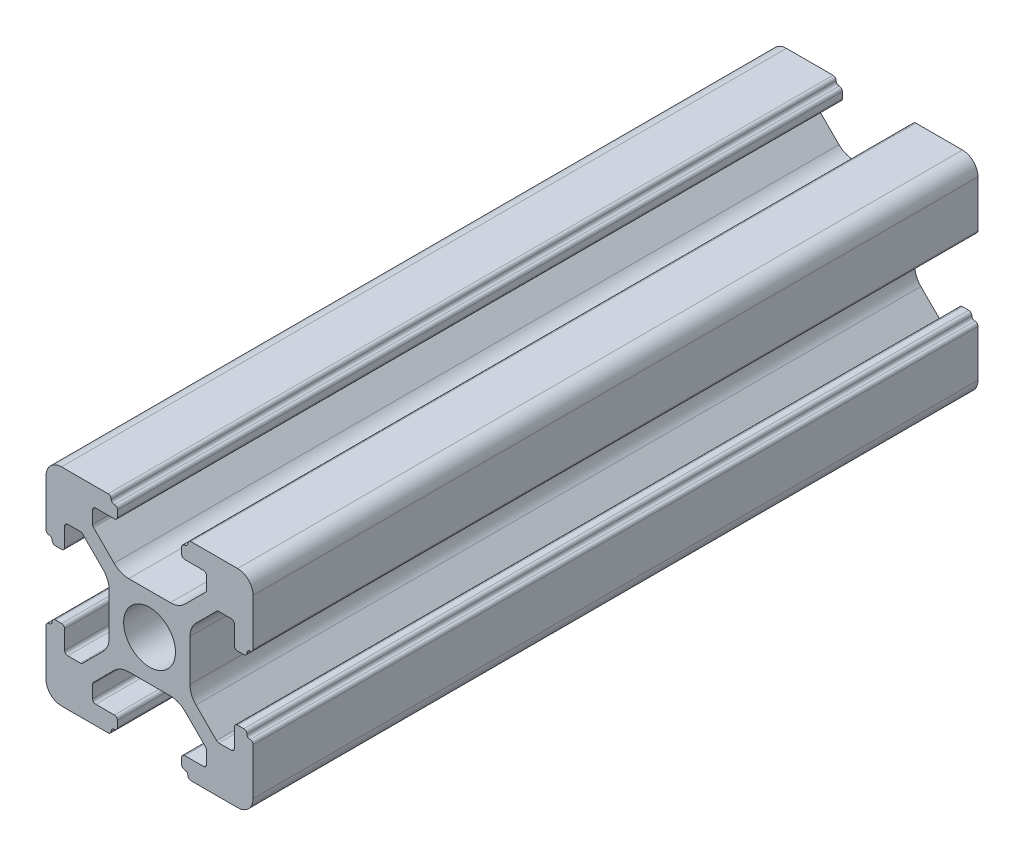
from build123d import *

# Parameters (mm, degrees)
SKETCH_1_R      = 2.5
EXTRUDE_1_DEPTH = 70


with BuildPart() as part:
    # 草图1 → 凸台-拉伸1 (new body)
    with BuildSketch(Plane.XY):
        with BuildLine():
            Line((-70.300601627, 44.610087446), (-70.300601627, 40.110087446))
            ThreePointArc((-70.300601627, 40.110087446), (-70.388469593, 39.897955411), (-70.600601627, 39.810087446))
            ThreePointArc((-70.600601627, 39.810087446), (-70.812733661, 39.72221948), (-70.900601627, 39.510087446))
            ThreePointArc((-70.900601627, 39.510087446), (-70.988469593, 39.297955411), (-71.200601627, 39.210087446))
            Line((-71.200601627, 39.210087446), (-71.800601627, 39.210087446))
            ThreePointArc((-71.800601627, 39.210087446), (-72.012733661, 39.297955411), (-72.100601627, 39.510087446))
            Line((-72.100601627, 39.510087446), (-72.100601627, 41.310087446))
            ThreePointArc((-72.100601627, 41.310087446), (-72.188469593, 41.52221948), (-72.400601627, 41.610087446))
            Line((-72.400601627, 41.610087446), (-73.615677387, 41.610087446))
            ThreePointArc((-73.615677387, 41.610087446), (-73.730482416, 41.587251306), (-73.827809421, 41.52221948))
            Line((-73.827809421, 41.52221948), (-75.814815189, 39.535213712))
            ThreePointArc((-75.814815189, 39.535213712), (-76.248360692, 38.886367014), (-76.400601627, 38.121000149))
            Line((-76.400601627, 38.121000149), (-76.400601627, 34.099174742))
            ThreePointArc((-76.400601627, 34.099174742), (-76.248360692, 33.333807878), (-75.814815189, 32.68496118))
            Line((-75.814815189, 32.68496118), (-73.827809421, 30.697955411))
            ThreePointArc((-73.827809421, 30.697955411), (-73.730482416, 30.632923586), (-73.615677387, 30.610087446))
            Line((-73.615677387, 30.610087446), (-72.400601627, 30.610087446))
            ThreePointArc((-72.400601627, 30.610087446), (-72.188469593, 30.697955411), (-72.100601627, 30.910087446))
            Line((-72.100601627, 30.910087446), (-72.100601627, 32.710087446))
            ThreePointArc((-72.100601627, 32.710087446), (-72.012733661, 32.92221948), (-71.800601627, 33.010087446))
            Line((-71.800601627, 33.010087446), (-71.200601627, 33.010087446))
            ThreePointArc((-71.200601627, 33.010087446), (-70.988469593, 32.92221948), (-70.900601627, 32.710087446))
            ThreePointArc((-70.900601627, 32.710087446), (-70.812733661, 32.497955411), (-70.600601627, 32.410087446))
            ThreePointArc((-70.600601627, 32.410087446), (-70.388469593, 32.32221948), (-70.300601627, 32.110087446))
            Line((-70.300601627, 32.110087446), (-70.300601627, 27.610087446))
            ThreePointArc((-70.300601627, 27.610087446), (-70.739941455, 26.549427274), (-71.800601627, 26.110087446))
            Line((-71.800601627, 26.110087446), (-76.300601627, 26.110087446))
            ThreePointArc((-76.300601627, 26.110087446), (-76.512733661, 26.197955411), (-76.600601627, 26.410087446))
            ThreePointArc((-76.600601627, 26.410087446), (-76.688469593, 26.62221948), (-76.900601627, 26.710087446))
            ThreePointArc((-76.900601627, 26.710087446), (-77.112733661, 26.797955411), (-77.200601627, 27.010087446))
            Line((-77.200601627, 27.010087446), (-77.200601627, 27.610087446))
            ThreePointArc((-77.200601627, 27.610087446), (-77.112733661, 27.82221948), (-76.900601627, 27.910087446))
            Line((-76.900601627, 27.910087446), (-75.100601627, 27.910087446))
            ThreePointArc((-75.100601627, 27.910087446), (-74.888469593, 27.997955411), (-74.800601627, 28.210087446))
            Line((-74.800601627, 28.210087446), (-74.800601627, 29.425163205))
            ThreePointArc((-74.800601627, 29.425163205), (-74.823437767, 29.539968235), (-74.888469593, 29.63729524))
            Line((-74.888469593, 29.63729524), (-76.875475361, 31.624301008))
            ThreePointArc((-76.875475361, 31.624301008), (-77.524322059, 32.057846511), (-78.289688924, 32.210087446))
            Line((-78.289688924, 32.210087446), (-82.311514331, 32.210087446))
            ThreePointArc((-82.311514331, 32.210087446), (-83.076881195, 32.057846511), (-83.725727893, 31.624301008))
            Line((-83.725727893, 31.624301008), (-85.712733661, 29.63729524))
            ThreePointArc((-85.712733661, 29.63729524), (-85.777765487, 29.539968235), (-85.800601627, 29.425163205))
            Line((-85.800601627, 29.425163205), (-85.800601627, 28.210087446))
            ThreePointArc((-85.800601627, 28.210087446), (-85.712733661, 27.997955411), (-85.500601627, 27.910087446))
            Line((-85.500601627, 27.910087446), (-83.700601627, 27.910087446))
            ThreePointArc((-83.700601627, 27.910087446), (-83.488469593, 27.82221948), (-83.400601627, 27.610087446))
            Line((-83.400601627, 27.610087446), (-83.400601627, 27.010087446))
            ThreePointArc((-83.400601627, 27.010087446), (-83.488469593, 26.797955411), (-83.700601627, 26.710087446))
            ThreePointArc((-83.700601627, 26.710087446), (-83.912733661, 26.62221948), (-84.000601627, 26.410087446))
            ThreePointArc((-84.000601627, 26.410087446), (-84.088469593, 26.197955411), (-84.300601627, 26.110087446))
            Line((-84.300601627, 26.110087446), (-88.800601627, 26.110087446))
            ThreePointArc((-88.800601627, 26.110087446), (-89.861261799, 26.549427274), (-90.300601627, 27.610087446))
            Line((-90.300601627, 27.610087446), (-90.300601627, 32.110087446))
            ThreePointArc((-90.300601627, 32.110087446), (-90.212733661, 32.32221948), (-90.000601627, 32.410087446))
            ThreePointArc((-90.000601627, 32.410087446), (-89.788469593, 32.497955411), (-89.700601627, 32.710087446))
            ThreePointArc((-89.700601627, 32.710087446), (-89.612733661, 32.92221948), (-89.400601627, 33.010087446))
            Line((-89.400601627, 33.010087446), (-88.800601627, 33.010087446))
            ThreePointArc((-88.800601627, 33.010087446), (-88.588469593, 32.92221948), (-88.500601627, 32.710087446))
            Line((-88.500601627, 32.710087446), (-88.500601627, 30.910087446))
            ThreePointArc((-88.500601627, 30.910087446), (-88.412733661, 30.697955411), (-88.200601627, 30.610087446))
            Line((-88.200601627, 30.610087446), (-86.985525868, 30.610087446))
            ThreePointArc((-86.985525868, 30.610087446), (-86.870720838, 30.632923586), (-86.773393833, 30.697955411))
            Line((-86.773393833, 30.697955411), (-84.786388065, 32.68496118))
            ThreePointArc((-84.786388065, 32.68496118), (-84.352842562, 33.333807878), (-84.200601627, 34.099174742))
            Line((-84.200601627, 34.099174742), (-84.200601627, 38.121000149))
            ThreePointArc((-84.200601627, 38.121000149), (-84.352842562, 38.886367014), (-84.786388065, 39.535213712))
            Line((-84.786388065, 39.535213712), (-86.773393833, 41.52221948))
            ThreePointArc((-86.773393833, 41.52221948), (-86.870720838, 41.587251306), (-86.985525868, 41.610087446))
            Line((-86.985525868, 41.610087446), (-88.200601627, 41.610087446))
            ThreePointArc((-88.200601627, 41.610087446), (-88.412733661, 41.52221948), (-88.500601627, 41.310087446))
            Line((-88.500601627, 41.310087446), (-88.500601627, 39.510087446))
            ThreePointArc((-88.500601627, 39.510087446), (-88.588469593, 39.297955411), (-88.800601627, 39.210087446))
            Line((-88.800601627, 39.210087446), (-89.400601627, 39.210087446))
            ThreePointArc((-89.400601627, 39.210087446), (-89.612733661, 39.297955411), (-89.700601627, 39.510087446))
            ThreePointArc((-89.700601627, 39.510087446), (-89.788469593, 39.72221948), (-90.000601627, 39.810087446))
            ThreePointArc((-90.000601627, 39.810087446), (-90.212733661, 39.897955411), (-90.300601627, 40.110087446))
            Line((-90.300601627, 40.110087446), (-90.300601627, 44.610087446))
            ThreePointArc((-90.300601627, 44.610087446), (-89.861261799, 45.670747618), (-88.800601627, 46.110087446))
            Line((-88.800601627, 46.110087446), (-84.300601627, 46.110087446))
            ThreePointArc((-84.300601627, 46.110087446), (-84.088469593, 46.02221948), (-84.000601627, 45.810087446))
            ThreePointArc((-84.000601627, 45.810087446), (-83.912733661, 45.597955411), (-83.700601627, 45.510087446))
            ThreePointArc((-83.700601627, 45.510087446), (-83.488469593, 45.42221948), (-83.400601627, 45.210087446))
            Line((-83.400601627, 45.210087446), (-83.400601627, 44.610087446))
            ThreePointArc((-83.400601627, 44.610087446), (-83.488469593, 44.397955411), (-83.700601627, 44.310087446))
            Line((-83.700601627, 44.310087446), (-85.500601627, 44.310087446))
            ThreePointArc((-85.500601627, 44.310087446), (-85.712733661, 44.22221948), (-85.800601627, 44.010087446))
            Line((-85.800601627, 44.010087446), (-85.800601627, 42.795011686))
            ThreePointArc((-85.800601627, 42.795011686), (-85.777765487, 42.680206657), (-85.712733661, 42.582879652))
            Line((-85.712733661, 42.582879652), (-83.725727893, 40.595873883))
            ThreePointArc((-83.725727893, 40.595873883), (-83.076881195, 40.162328381), (-82.311514331, 40.010087446))
            Line((-82.311514331, 40.010087446), (-78.289688924, 40.010087446))
            ThreePointArc((-78.289688924, 40.010087446), (-77.524322059, 40.162328381), (-76.875475361, 40.595873883))
            Line((-76.875475361, 40.595873883), (-74.888469593, 42.582879652))
            ThreePointArc((-74.888469593, 42.582879652), (-74.823437767, 42.680206657), (-74.800601627, 42.795011686))
            Line((-74.800601627, 42.795011686), (-74.800601627, 44.010087446))
            ThreePointArc((-74.800601627, 44.010087446), (-74.888469593, 44.22221948), (-75.100601627, 44.310087446))
            Line((-75.100601627, 44.310087446), (-76.900601627, 44.310087446))
            ThreePointArc((-76.900601627, 44.310087446), (-77.112733661, 44.397955411), (-77.200601627, 44.610087446))
            Line((-77.200601627, 44.610087446), (-77.200601627, 45.210087446))
            ThreePointArc((-77.200601627, 45.210087446), (-77.112733661, 45.42221948), (-76.900601627, 45.510087446))
            ThreePointArc((-76.900601627, 45.510087446), (-76.688469593, 45.597955411), (-76.600601627, 45.810087446))
            ThreePointArc((-76.600601627, 45.810087446), (-76.512733661, 46.02221948), (-76.300601627, 46.110087446))
            Line((-76.300601627, 46.110087446), (-71.800601627, 46.110087446))
            ThreePointArc((-71.800601627, 46.110087446), (-70.739941455, 45.670747618), (-70.300601627, 44.610087446))
        make_face()
        with Locations((-80.300601627, 36.110087446)):
            Circle(SKETCH_1_R, mode=Mode.SUBTRACT)
    extrude(amount=EXTRUDE_1_DEPTH)


solid = part.part
